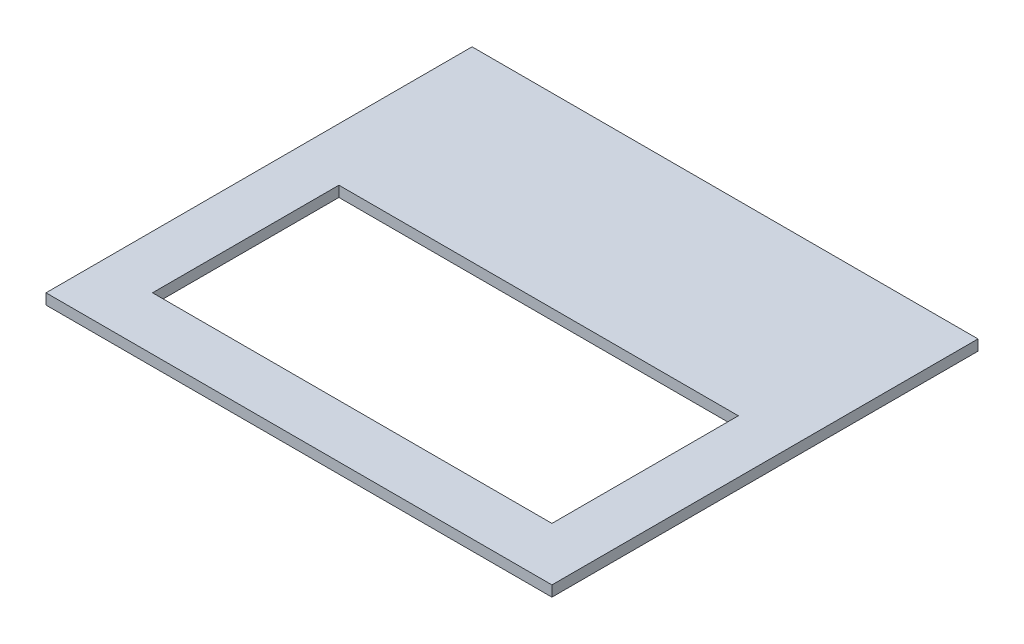
from build123d import *

# Parameters (mm, degrees)
SKETCH1_W           = 150
SKETCH1_H           = 70
BOSS_EXTRUDE1_DEPTH = 4


with BuildPart() as part:
    # Sketch1 → Boss-Extrude1 (new body)
    with BuildSketch(Plane(origin=(0, 0, 0), x_dir=(1, 0, 0), z_dir=(0, 1, 0))):
        Polygon((-95, 55), (-95, 105), (95, 105), (95, 55), (95, -55), (-95, -55), align=None)
        Rectangle(SKETCH1_W, SKETCH1_H, mode=Mode.SUBTRACT)
    extrude(amount=BOSS_EXTRUDE1_DEPTH)


solid = part.part
